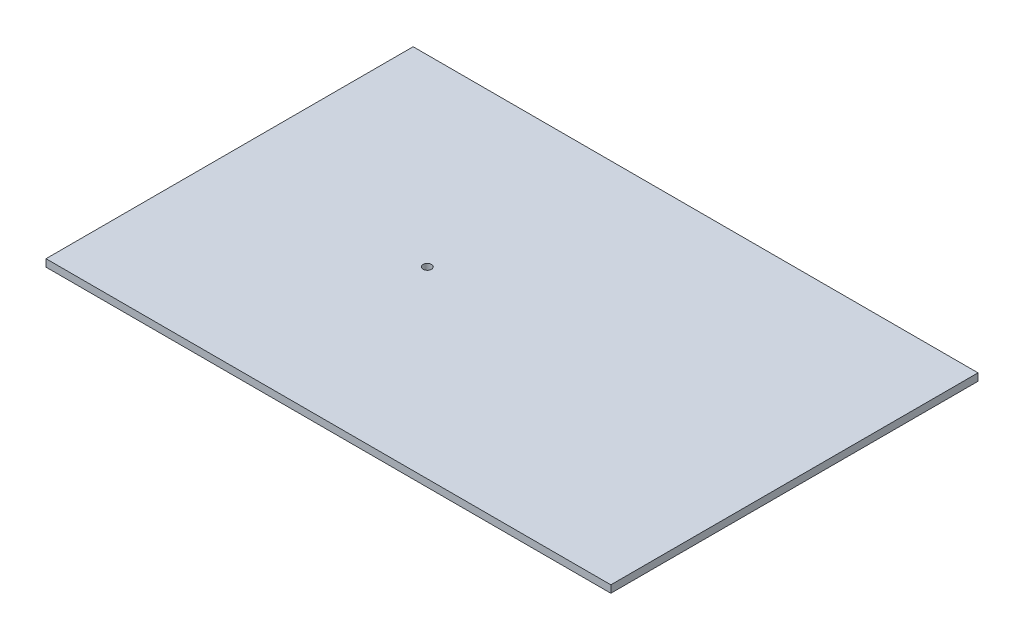
from build123d import *

# Parameters (mm, degrees)
BOSS_EXTRUDE1_DEPTH = 3.302


with BuildPart() as part:
    # Sketch2 → Boss-Extrude1 (new body)
    with BuildSketch(Plane(origin=(0, 0, 0), x_dir=(1, 0, 0), z_dir=(0, 1, 0))):
        with BuildLine():
            Line((-127, 0), (-127, -82.55))
            Line((-127, -82.55), (127, -82.55))
            Line((127, -82.55), (127, 82.55))
            Line((127, 82.55), (-38.1, 82.55))
            Line((-38.1, 82.55), (-38.1, 1.905))
            ThreePointArc((-38.1, 1.905), (-36.752961582, 1.347038418), (-36.195, 0))
            ThreePointArc((-36.195, 0), (-38.1, -1.905), (-40.005, 0))
            Line((-40.005, 0), (-127, 0))
        make_face()
        with BuildLine():
            Line((-127, 82.55), (-127, 0))
            Line((-127, 0), (-40.005, 0))
            ThreePointArc((-40.005, 0), (-39.447038418, 1.347038418), (-38.1, 1.905))
            Line((-38.1, 1.905), (-38.1, 82.55))
            Line((-38.1, 82.55), (-127, 82.55))
        make_face()
    extrude(amount=BOSS_EXTRUDE1_DEPTH)


solid = part.part
